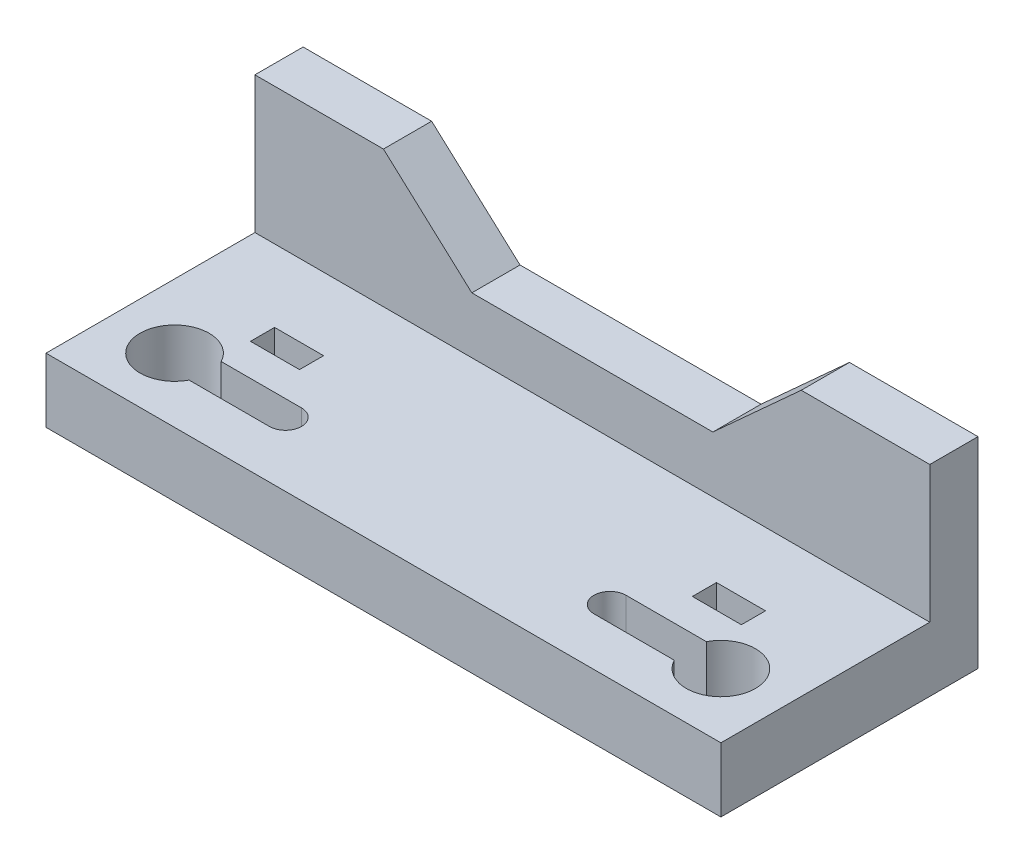
from build123d import *

# Parameters (mm, degrees)
SKETCH2_W           = 84
SKETCH2_H           = 32
SKETCH2_W_2         = 6.1
SKETCH2_H_2         = 3
BOSS_EXTRUDE2_DEPTH = 8
BOSS_EXTRUDE3_DEPTH = 6
SKETCH4_R           = 5.5
CUT_EXTRUDE1_DEPTH  = 1


with BuildPart() as part:
    # Sketch2 → Boss-Extrude2 (new body)
    with BuildSketch(Plane(origin=(0, 0, 0), x_dir=(1, 0, 0), z_dir=(0, 1, 0))):
        with Locations((0, 16)):
            Rectangle(SKETCH2_W, SKETCH2_H)
        with BuildLine():
            ThreePointArc((20.193426738, 10), (18.193426738, 8), (20.193426738, 6))
            Line((20.193426738, 6), (30.193426738, 6))
            ThreePointArc((30.193426738, 6), (38.3, 8), (30.193426738, 10))
            Line((30.193426738, 10), (20.193426738, 10))
        make_face(mode=Mode.SUBTRACT)
        with BuildLine():
            ThreePointArc((-30.193426738, 10), (-38.3, 8), (-30.193426738, 6))
            Line((-30.193426738, 6), (-20.193426738, 6))
            ThreePointArc((-20.193426738, 6), (-18.193426738, 8), (-20.193426738, 10))
            Line((-20.193426738, 10), (-30.193426738, 10))
        make_face(mode=Mode.SUBTRACT)
        with Locations((27.5, 15.5)):
            Rectangle(SKETCH2_W_2, SKETCH2_H_2, mode=Mode.SUBTRACT)
        with Locations((-27.5, 15.5)):
            Rectangle(SKETCH2_W_2, SKETCH2_H_2, mode=Mode.SUBTRACT)
    extrude(amount=BOSS_EXTRUDE2_DEPTH)

    # Sketch3 → Boss-Extrude3 (add)
    with BuildSketch(Plane(origin=(0, 0, -32), x_dir=(-1, 0, 0), z_dir=(0, 0, -1))):
        Polygon((-42, 8), (-42, 25), (-26, 25), (-15, 15), (15, 15), (26, 25), (42, 25), (42, 8), align=None)
    extrude(amount=-BOSS_EXTRUDE3_DEPTH)

    # Sketch4 → Cut-Extrude1 (cut)
    with BuildSketch(Plane(origin=(0, 0, -32), x_dir=(-1, 0, 0), z_dir=(0, 0, -1))):
        with Locations((32, 15)):
            Circle(SKETCH4_R)
        with Locations(Location((-32, 15, 0), (0, 0, 180))):
            Circle(SKETCH4_R)
    extrude(amount=-CUT_EXTRUDE1_DEPTH, mode=Mode.SUBTRACT)


solid = part.part
